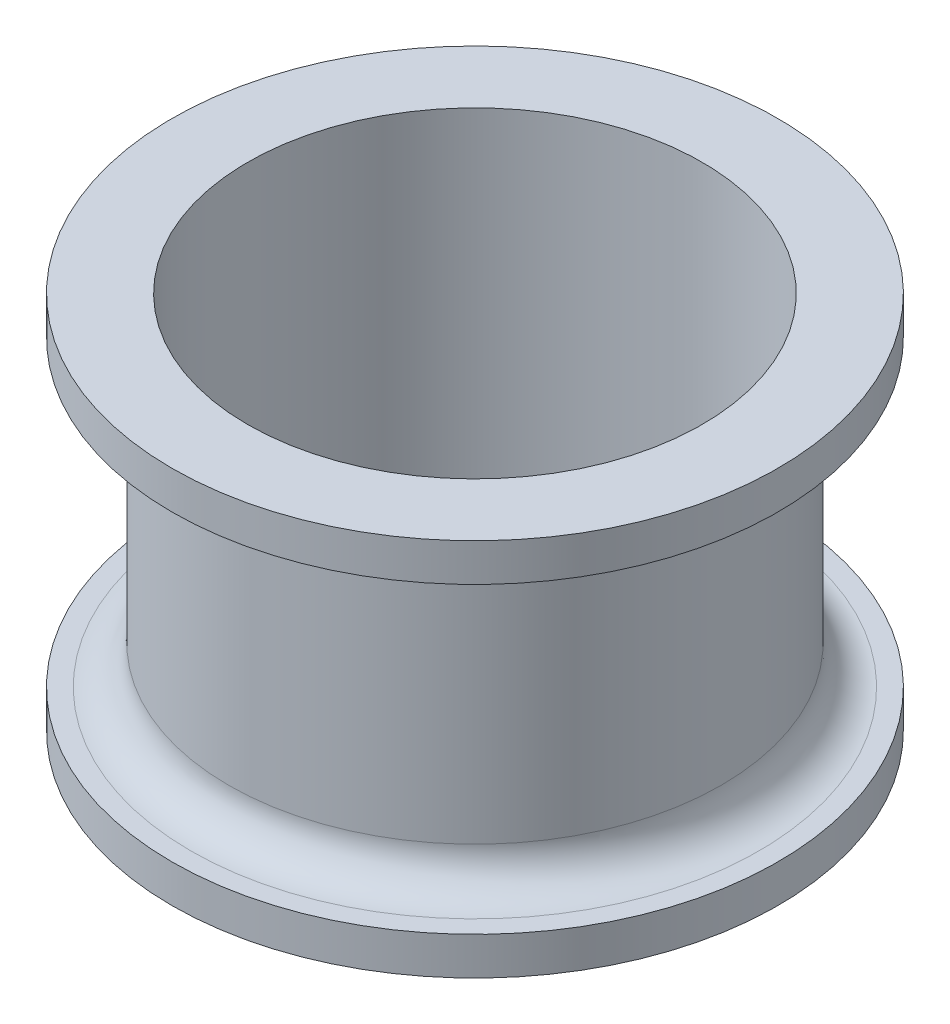
from build123d import *

# Parameters (mm, degrees)
SKETCH1_R           = 6.5
SKETCH1_R_2         = 6
BOSS_EXTRUDE1_DEPTH = 10
BOSS_EXTRUDE2_START = -1
SKETCH2_R           = 8
SKETCH2_R_2         = 6
BOSS_EXTRUDE2_DEPTH = 1
LPATTERN1_COUNT     = 2
LPATTERN1_PITCH     = 9
FILLET1_R           = 1


with BuildPart() as part:
    # Sketch1 → Boss-Extrude1 (new body)
    with BuildSketch(Plane(origin=(0, 0, 0), x_dir=(1, 0, 0), z_dir=(0, 1, 0))):
        with Locations(Location((0, 0, 0), (0, 0, 270))):
            Circle(SKETCH1_R)
        with Locations(Location((0, 0, 0), (0, 0, 270))):
            Circle(SKETCH1_R_2, mode=Mode.SUBTRACT)
    extrude(amount=BOSS_EXTRUDE1_DEPTH)

    # Sketch2 → Boss-Extrude2 (add)
    with BuildSketch(Plane(origin=(0, 10, 0), x_dir=(1, 0, 0), z_dir=(0, 1, 0)).offset(BOSS_EXTRUDE2_START)):
        with Locations(Location((0, 0, 0), (0, 0, 270))):
            Circle(SKETCH2_R)
        with Locations(Location((0, 0, 0), (0, 0, 270))):
            Circle(SKETCH2_R_2, mode=Mode.SUBTRACT)
    boss_extrude2 = extrude(amount=BOSS_EXTRUDE2_DEPTH)

    # LPattern1: Boss-Extrude2 ×2
    with Locations(*[(0, -i * LPATTERN1_PITCH, 0) for i in range(1, LPATTERN1_COUNT)]):
        add(boss_extrude2)

    # Fillet1
    fillet1_edges = [part.edges().sort_by_distance(p)[0] for p in [
        (0, 9, -6.5),
        (0, 1, -6.5),
    ]]
    fillet(fillet1_edges, radius=FILLET1_R)


solid = part.part
